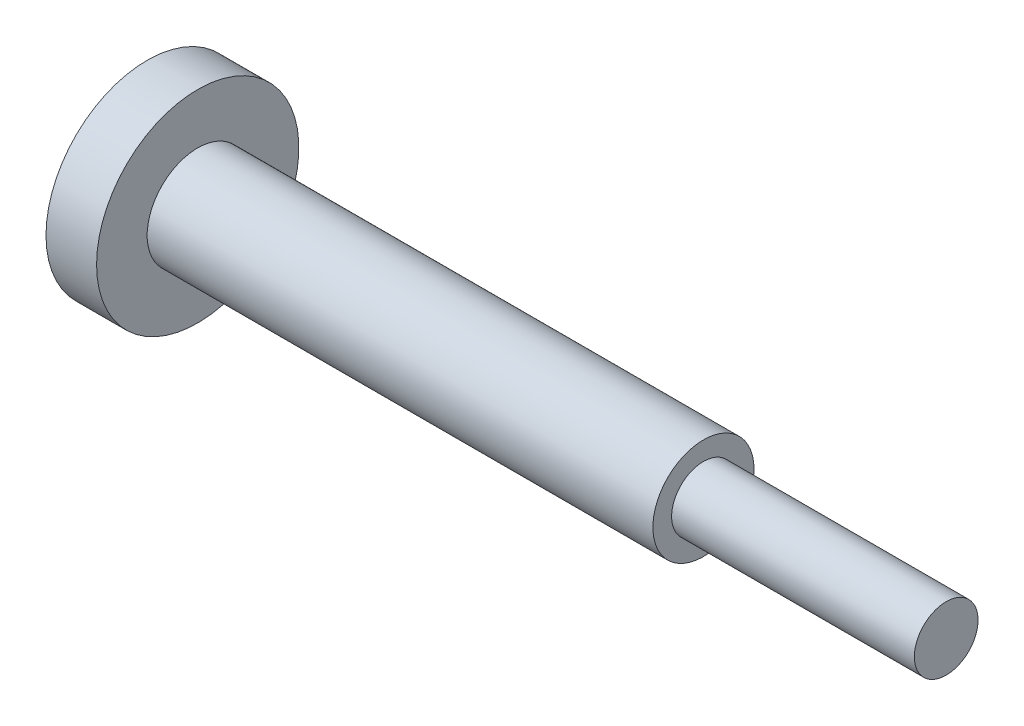
from build123d import *

# Parameters (mm, degrees)
SKETCH1_R           = 2
BOSS_EXTRUDE1_DEPTH = 15.24
SKETCH1_3_R         = 3.175
BOSS_EXTRUDE2_DEPTH = 31.75
SKETCH2_R           = 6.35
BOSS_EXTRUDE3_DEPTH = 3.175


with BuildPart() as part:
    # Sketch1 → Boss-Extrude1 (new body)
    with BuildSketch(Plane(origin=(0, 0, 0), x_dir=(0, 0, -1), z_dir=(1, 0, 0))):
        Circle(SKETCH1_R)
    extrude(amount=BOSS_EXTRUDE1_DEPTH)

    # Sketch1<3> → Boss-Extrude2 (add)
    with BuildSketch(Plane(origin=(0, 0, 0), x_dir=(0, 0, -1), z_dir=(1, 0, 0))):
        Circle(SKETCH1_3_R)
    extrude(amount=-BOSS_EXTRUDE2_DEPTH)

    # Sketch2 → Boss-Extrude3 (add)
    with BuildSketch(Plane.ZY.offset(31.75)):
        Circle(SKETCH2_R)
    extrude(amount=BOSS_EXTRUDE3_DEPTH)


solid = part.part
